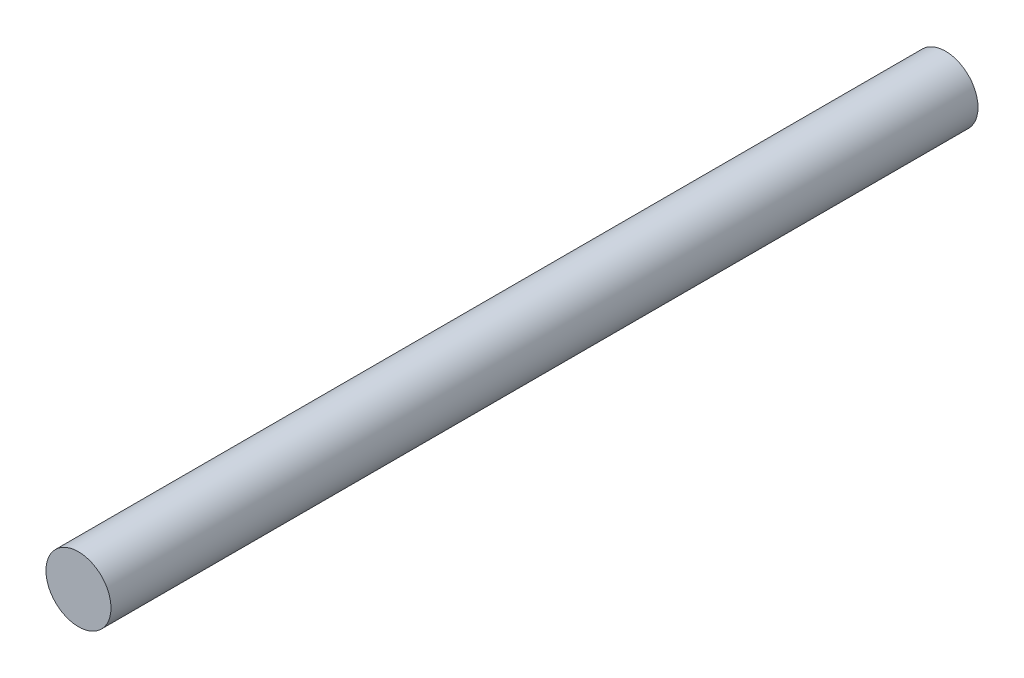
from build123d import *

# Parameters (mm, degrees)
ESQUISSE1_R        = 1.5
BOSS_EXTRU_1_DEPTH = 40


with BuildPart() as part:
    # Esquisse1 → Boss.-Extru.1 (new body)
    with BuildSketch(Plane.XY):
        Circle(ESQUISSE1_R)
    extrude(amount=BOSS_EXTRU_1_DEPTH)


solid = part.part
